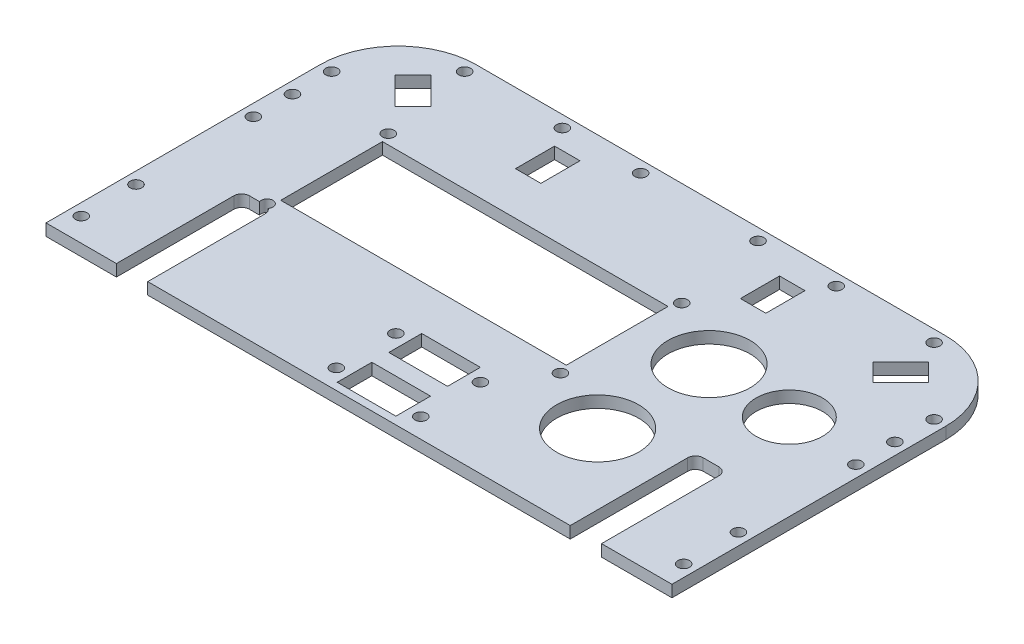
from build123d import *

# Parameters (mm, degrees)
CROQUIS1_R              = 1.5
CROQUIS1_R_2            = 10.5
CROQUIS1_R_3            = 8.5
CROQUIS1_W              = 73
CROQUIS1_H              = 26
CROQUIS1_W_2            = 6.5
CROQUIS1_H_2            = 10
SALIENTE_EXTRUIR2_DEPTH = 3
CORTAR_EXTRUIR1_DEPTH   = 10
CROQUIS3_R              = 1.5
CORTAR_EXTRUIR2_DEPTH   = 10
CROQUIS4_W              = 15
CROQUIS4_H              = 8.401372908
CROQUIS4_H_2            = 8.862986804
CORTAR_EXTRUIR3_DEPTH   = 10


with BuildPart() as part:
    # Croquis1 → Saliente-Extruir2 (new body)
    with BuildSketch(Plane(origin=(0, 0, 0), x_dir=(1, 0, 0), z_dir=(0, 1, 0))):
        with BuildLine():
            Line((-20, 0), (-140, 0))
            ThreePointArc((-140, 0), (-154.142135624, -5.857864376), (-160, -20))
            Line((-160, -20), (-160, -90))
            Line((-160, -90), (0, -90))
            Line((0, -90), (0, -20))
            ThreePointArc((0, -20), (-5.857864376, -5.857864376), (-20, 0))
        make_face()
        with Locations(Location((-61, -26.5, 0), (0, 0, 270))):
            Circle(CROQUIS1_R, mode=Mode.SUBTRACT)
        with Locations(Location((-61, -57.5, 0), (0, 0, 270))):
            Circle(CROQUIS1_R, mode=Mode.SUBTRACT)
        with Locations(Location((-136, -57.5, 0), (0, 0, 270))):
            Circle(CROQUIS1_R, mode=Mode.SUBTRACT)
        with Locations(Location((-136, -26.5, 0), (0, 0, 270))):
            Circle(CROQUIS1_R, mode=Mode.SUBTRACT)
        with Locations(Location((-44, -65, 0), (0, 0, 270))):
            Circle(CROQUIS1_R_2, mode=Mode.SUBTRACT)
        with Locations(Location((-44, -36.51645059, 0), (0, 0, 270))):
            Circle(CROQUIS1_R_2, mode=Mode.SUBTRACT)
        with Locations(Location((-22, -38, 0), (0, 0, 270))):
            Circle(CROQUIS1_R_3, mode=Mode.SUBTRACT)
        with Locations(Location((-90.795, -69.76, 0), (0, 0, 270))):
            Circle(CROQUIS1_R, mode=Mode.SUBTRACT)
        with Locations(Location((-69.205, -69.76, 0), (0, 0, 270))):
            Circle(CROQUIS1_R, mode=Mode.SUBTRACT)
        with Locations(Location((-69.205, -85, 0), (0, 0, 270))):
            Circle(CROQUIS1_R, mode=Mode.SUBTRACT)
        with Locations(Location((-90.795, -85, 0), (0, 0, 270))):
            Circle(CROQUIS1_R, mode=Mode.SUBTRACT)
        with Locations((-98.5, -42)):
            Rectangle(CROQUIS1_W, CROQUIS1_H, mode=Mode.SUBTRACT)
        Polygon((-148.16726189, -12.596194078), (-143.571067812, -8), (-136.5, -15.071067812), (-141.096194078, -19.66726189), align=None, mode=Mode.SUBTRACT)
        with Locations((-51.25, -13)):
            Rectangle(CROQUIS1_W_2, CROQUIS1_H_2, mode=Mode.SUBTRACT)
        with Locations((-108.75, -13)):
            Rectangle(CROQUIS1_W_2, CROQUIS1_H_2, mode=Mode.SUBTRACT)
        Polygon((-16.428932188, -8), (-11.83273811, -12.596194078), (-18.903805922, -19.66726189), (-23.5, -15.071067812), align=None, mode=Mode.SUBTRACT)
    extrude(amount=SALIENTE_EXTRUIR2_DEPTH)

    # Croquis2 → Cortar-Extruir1 (cut)
    with BuildSketch(Plane(origin=(0, 3, 0), x_dir=(1, 0, 0), z_dir=(0, 1, 0))):
        with BuildLine():
            Line((-142, -90), (-134, -90))
            Line((-134, -90), (-134, -60))
            ThreePointArc((-134, -60), (-134.585786438, -58.585786438), (-136, -58))
            Line((-136, -58), (-140, -58))
            ThreePointArc((-140, -58), (-141.414213562, -58.585786438), (-142, -60))
            Line((-142, -60), (-142, -90))
        make_face()
        with BuildLine():
            Line((-26, -90), (-18, -90))
            Line((-18, -90), (-18, -60))
            ThreePointArc((-18, -60), (-18.585786438, -58.585786438), (-20, -58))
            Line((-20, -58), (-24, -58))
            ThreePointArc((-24, -58), (-25.414213562, -58.585786438), (-26, -60))
            Line((-26, -60), (-26, -90))
        make_face()
    extrude(amount=-CORTAR_EXTRUIR1_DEPTH, mode=Mode.SUBTRACT)

    # Croquis3 → Cortar-Extruir2 (cut)
    with BuildSketch(Plane(origin=(0, 3, 0), x_dir=(1, 0, 0), z_dir=(0, 1, 0))):
        with Locations(Location((-157, -84, 0), (0, 0, 270))):
            Circle(CROQUIS3_R)
        with Locations(Location((-157, -70, 0), (0, 0, 270))):
            Circle(CROQUIS3_R)
        with Locations(Location((-157, -40, 0), (0, 0, 270))):
            Circle(CROQUIS3_R)
        with Locations(Location((-157, -30, 0), (0, 0, 270))):
            Circle(CROQUIS3_R)
        with Locations(Location((-140, -3, 0), (0, 0, 270))):
            Circle(CROQUIS3_R)
        with Locations(Location((-115, -3, 0), (0, 0, 270))):
            Circle(CROQUIS3_R)
        with Locations(Location((-95, -3, 0), (0, 0, 270))):
            Circle(CROQUIS3_R)
        with Locations(Location((-65, -3, 0), (0, 0, 270))):
            Circle(CROQUIS3_R)
        with Locations(Location((-45, -3, 0), (0, 0, 270))):
            Circle(CROQUIS3_R)
        with Locations(Location((-20, -3, 0), (0, 0, 270))):
            Circle(CROQUIS3_R)
        with Locations(Location((-3, -30, 0), (0, 0, 270))):
            Circle(CROQUIS3_R)
        with Locations(Location((-3, -40, 0), (0, 0, 270))):
            Circle(CROQUIS3_R)
        with Locations(Location((-3, -70, 0), (0, 0, 270))):
            Circle(CROQUIS3_R)
        with Locations(Location((-3, -84, 0), (0, 0, 270))):
            Circle(CROQUIS3_R)
        with Locations(Location((-157, -20, 0), (0, 0, 270))):
            Circle(CROQUIS3_R)
        with Locations(Location((-3, -20, 0), (0, 0, 270))):
            Circle(CROQUIS3_R)
    extrude(amount=-CORTAR_EXTRUIR2_DEPTH, mode=Mode.SUBTRACT)

    # Croquis4 → Cortar-Extruir3 (cut)
    with BuildSketch(Plane(origin=(0, 3, 0), x_dir=(1, 0, 0), z_dir=(0, 1, 0))):
        with Locations((-80, -70.663029374)):
            Rectangle(CROQUIS4_W, CROQUIS4_H)
        with Locations((-80, -83.634379853)):
            Rectangle(CROQUIS4_W, CROQUIS4_H_2)
    extrude(amount=-CORTAR_EXTRUIR3_DEPTH, mode=Mode.SUBTRACT)


solid = part.part
